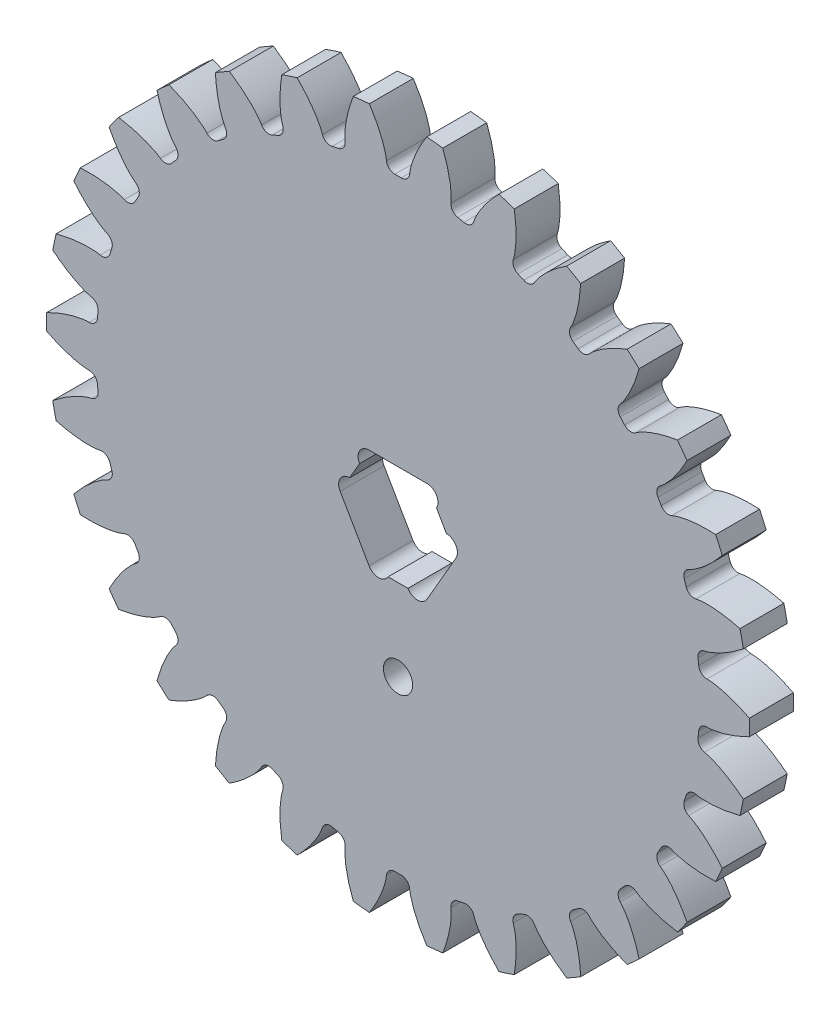
from build123d import *

# Parameters (mm, degrees)
SKETCH_1_R          = 24
LASHENA_DEPTH       = 3
CUT_EXTRUDEA_DEPTH  = 3
WWW_KYTOOL_CN_COUNT = 30
CUT_EXTRUDE_2_DEPTH = 35.0171108
SKETCH_4_R          = 1
CUT_EXTRUDE_3_DEPTH = 35.0171108
SKETCH_6_R          = 0.75
CUT_EXTRUDE_5_DEPTH = 35.0171108


with BuildPart() as part:
    # 草图1 → LaShenA (new body)
    with BuildSketch(Plane.XY):
        Circle(SKETCH_1_R)
    extrude(amount=LASHENA_DEPTH)

    # SketchA → Cut-ExtrudeA (cut)
    with BuildSketch(Plane.XY.offset(3)):
        with BuildLine():
            ThreePointArc((0.21835648, 20.6238441), (0, 20.625), (-0.21835648, 20.6238441))
            ThreePointArc((-0.21835648, 20.6238441), (-0.602204976, 20.767014024), (-0.790881832, 21.130659923))
            add(Edge.make_bspline(
                [(-0.790881832, 21.130659923), (-0.792712726, 21.147083487), (-0.799807796, 21.208486598), (-0.811224099, 21.291013994), (-0.827882593, 21.380751008), (-0.842697648, 21.452838437), (-0.861156548, 21.533768203), (-0.883586313, 21.623426547), (-0.910378909, 21.721674061), (-0.94190051, 21.828363714), (-0.978519667, 21.943335309), (-1.02059813, 22.066417362), (-1.068493226, 22.197426692), (-1.122556711, 22.336168726), (-1.183134695, 22.482437593), (-1.250567248, 22.636016298), (-1.325188108, 22.796676879), (-1.407324362, 22.964180584), (-1.497296145, 23.138278048), (-1.595416337, 23.318709485), (-1.701990264, 23.505204882), (-1.817315406, 23.697484207), (-1.941681138, 23.895257616), (-2.075368325, 24.098225682), (-2.26997178, 24.380531299), (-2.425489689, 24.591274524), (-2.533891181, 24.732086381)],
                knots=[0.114616515, 0.114616515, 0.114616515, 0.114616515, 0.125462231, 0.155251243, 0.169304968, 0.185420009, 0.203596367, 0.223834041, 0.246133032, 0.270493339, 0.296914963, 0.325397903, 0.35594216, 0.388547734, 0.423214624, 0.459942831, 0.498732354, 0.539583194, 0.582495351, 0.627468824, 0.674503613, 0.72359972, 0.774757143, 0.827975882, 0.883255938, 1, 1, 1, 1], degree=3))
            ThreePointArc((-2.533891181, 24.732086381), (0, 24.861550661), (2.533891181, 24.732086381))
            add(Edge.make_bspline(
                [(0.790881832, 21.130659923), (0.792712726, 21.147083487), (0.799807796, 21.208486598), (0.811224099, 21.291013994), (0.827882593, 21.380751008), (0.842697648, 21.452838437), (0.861156548, 21.533768203), (0.883586313, 21.623426547), (0.910378909, 21.721674061), (0.94190051, 21.828363714), (0.978519667, 21.943335309), (1.02059813, 22.066417362), (1.068493226, 22.197426692), (1.122556711, 22.336168726), (1.183134695, 22.482437593), (1.250567248, 22.636016298), (1.325188108, 22.796676879), (1.407324362, 22.964180584), (1.497296145, 23.138278048), (1.595416337, 23.318709485), (1.701990264, 23.505204882), (1.817315406, 23.697484207), (1.941681138, 23.895257616), (2.075368325, 24.098225682), (2.26997178, 24.380531299), (2.425489689, 24.591274524), (2.533891181, 24.732086381)],
                knots=[0.114616515, 0.114616515, 0.114616515, 0.114616515, 0.125462231, 0.155251243, 0.169304968, 0.185420009, 0.203596367, 0.223834041, 0.246133032, 0.270493339, 0.296914963, 0.325397903, 0.35594216, 0.388547734, 0.423214624, 0.459942831, 0.498732354, 0.539583194, 0.582495351, 0.627468824, 0.674503613, 0.72359972, 0.774757143, 0.827975882, 0.883255938, 1, 1, 1, 1], degree=3))
            ThreePointArc((0.790881832, 21.130659923), (0.602204976, 20.767014024), (0.21835648, 20.6238441))
        make_face()
    cut_extrudea = extrude(amount=-CUT_EXTRUDEA_DEPTH, mode=Mode.SUBTRACT)

    # www.KYTool.cn: Cut-ExtrudeA ×30 about axis
    www_kytool_cn_axis = Axis((0, 0, -88.99), (0, 0, 1))
    for i in range(1, WWW_KYTOOL_CN_COUNT):
        add(cut_extrudea.rotate(www_kytool_cn_axis, i * 360 / WWW_KYTOOL_CN_COUNT), mode=Mode.SUBTRACT)

    # 草图3 → 切除-拉伸2 (cut, through all)
    with BuildSketch(Plane.XY.offset(3)):
        Polygon((3.954849344, 0), (1.977424672, 3.425), (-1.977424672, 3.425), (-3.954849344, 0), (-1.977424672, -3.425), (1.977424672, -3.425), align=None)
    extrude(amount=-CUT_EXTRUDE_2_DEPTH, mode=Mode.SUBTRACT)

    # 草图4 → 切除-拉伸3 (cut, through all)
    with BuildSketch(Plane.XY.offset(3)):
        with Locations((0, -9)):
            Circle(SKETCH_4_R)
    extrude(amount=-CUT_EXTRUDE_3_DEPTH, mode=Mode.SUBTRACT)

    # 草图6 → 切除-拉伸5 (cut, through all)
    with BuildSketch(Plane.XY.offset(3)):
        with Locations((3.305330291, 0.375)):
            Circle(SKETCH_6_R)
        with Locations((-3.305330291, 0.375)):
            Circle(SKETCH_6_R)
        with Locations((-1.977424672, 2.675)):
            Circle(SKETCH_6_R)
        with Locations((1.327905619, -3.05)):
            Circle(SKETCH_6_R)
        with Locations((-1.327905619, -3.05)):
            Circle(SKETCH_6_R)
        with Locations((1.977424672, 2.675)):
            Circle(SKETCH_6_R)
    extrude(amount=-CUT_EXTRUDE_5_DEPTH, mode=Mode.SUBTRACT)


solid = part.part
